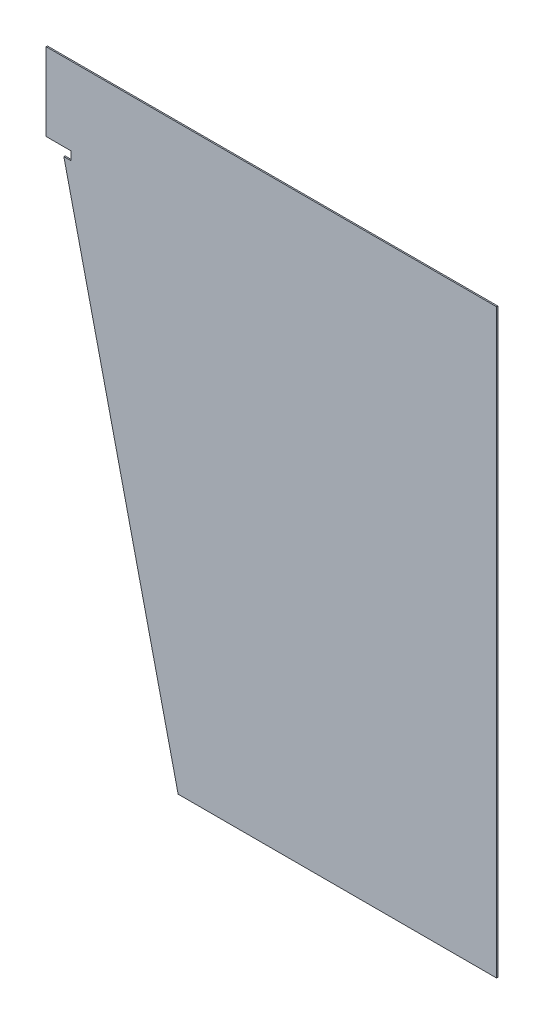
from build123d import *

# Parameters (mm, degrees)
SALIENTE_EXTRUIR1_DEPTH = 1.9


with BuildPart() as part:
    # Croquis1 → Saliente-Extruir1 (new body)
    with BuildSketch(Plane.XY):
        Polygon((0, 0), (0, -115.76), (37, -115.76), (37, -128.46), (26.24, -128.46), (196.283657492, -865), (670, -865), (670, 0), align=None)
    extrude(amount=SALIENTE_EXTRUIR1_DEPTH)


solid = part.part
